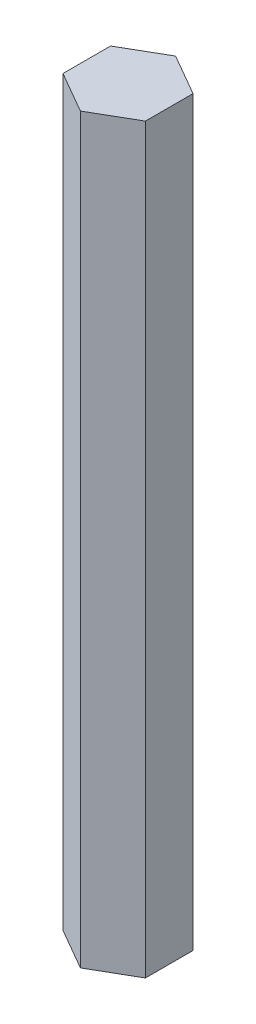
from build123d import *

# Parameters (mm, degrees)
EXTRUDE_1_DEPTH = 54


with BuildPart() as part:
    # 스케치1 → 보스-돌출1 (new body)
    with BuildSketch(Plane(origin=(0, 0, 0), x_dir=(1, 0, 0), z_dir=(0, 1, 0))):
        Polygon((0, -3.464101615), (3, -1.732050808), (3, 1.732050808), (0, 3.464101615), (-3, 1.732050808), (-3, -1.732050808), align=None)
    extrude(amount=EXTRUDE_1_DEPTH)


solid = part.part
